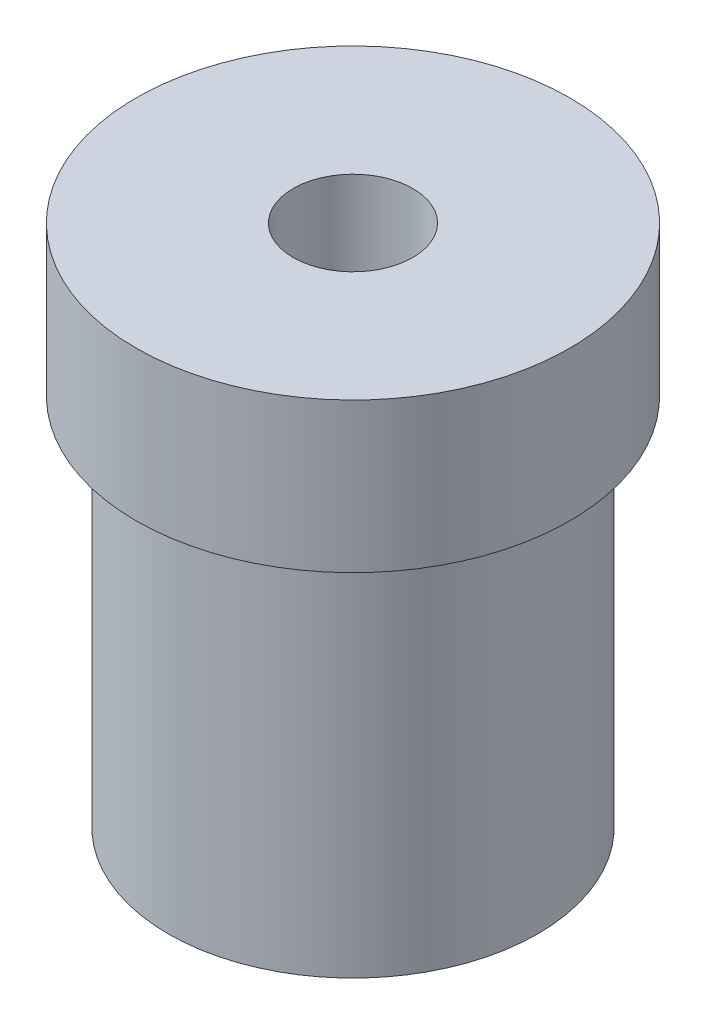
from build123d import *

# Parameters (mm, degrees)
SKETCH1_R               = 12.35
BOSS_EXTRUDE1_DEPTH     = 25
SKETCH2_R               = 14.5
BOSS_EXTRUDE2_DEPTH     = 10
CUT_EXTRUDE1_DEPTH      = 41.564763034
CUT_EXTRUDE1_DEPTH_BACK = 41.564763034
SKETCH3_R               = 4


with BuildPart() as part:
    # Sketch1 → Boss-Extrude1 (new body)
    with BuildSketch(Plane(origin=(0, 0, 0), x_dir=(1, 0, 0), z_dir=(0, 1, 0))):
        with Locations(Location((0, 0, 0), (0, 0, 270))):
            Circle(SKETCH1_R)
    extrude(amount=BOSS_EXTRUDE1_DEPTH)

    # Sketch2 → Boss-Extrude2 (add)
    with BuildSketch(Plane(origin=(0, 25, 0), x_dir=(1, 0, 0), z_dir=(0, 1, 0))):
        with Locations(Location((0, 0, 0), (0, 0, 270))):
            Circle(SKETCH2_R)
    extrude(amount=BOSS_EXTRUDE2_DEPTH)

    # Sketch3 → Cut-Extrude1 (cut, two sides: drawn at the far end of the back side and taken through both)
    with BuildSketch(Plane(origin=(0, 35, 0), x_dir=(1, 0, 0), z_dir=(0, 1, 0)).offset(-CUT_EXTRUDE1_DEPTH_BACK)):
        with Locations(Location((0, 0, 0), (0, 0, 270))):
            Circle(SKETCH3_R)
    extrude(amount=CUT_EXTRUDE1_DEPTH + CUT_EXTRUDE1_DEPTH_BACK, mode=Mode.SUBTRACT)


solid = part.part
